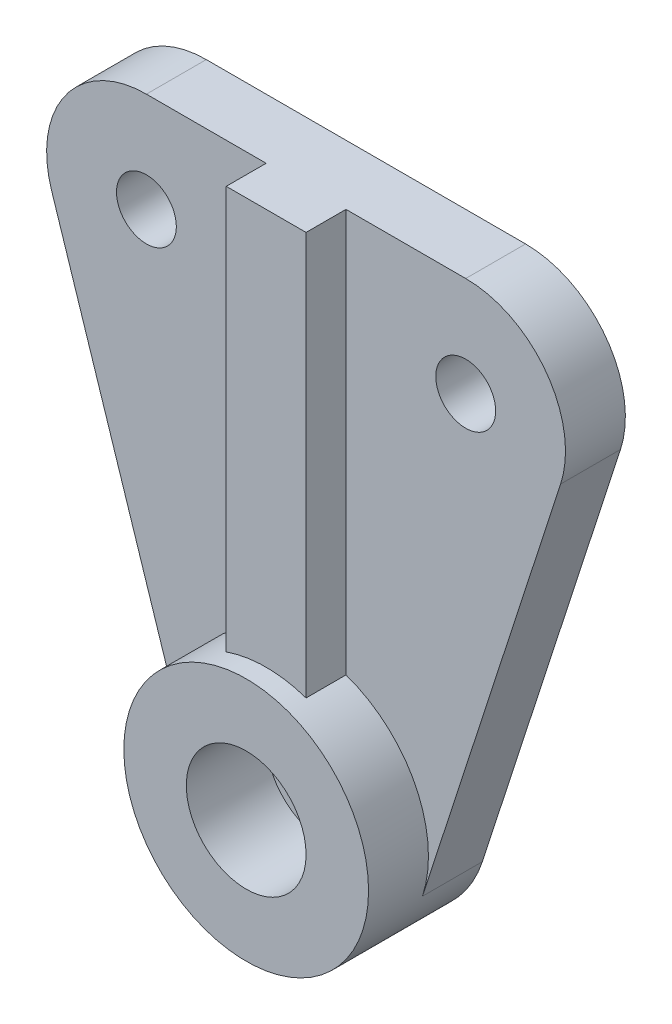
from build123d import *
from build123d.topology import SkipClean

# Parameters (mm, degrees)
SZKIC1_R                    = 2.75
SZKIC1_R_2                  = 1.5
DODANIE_WYCI_GNI_CIE1_DEPTH = 3
SZKIC2_R                    = 6.131623165
SZKIC2_R_2                  = 2.75
DODANIE_WYCI_GNI_CIE2_DEPTH = 3
SZKIC3_R                    = 3
SZKIC3_R_2                  = 1.6
DODANIE_WYCI_GNI_CIE3_DEPTH = 2
SZKIC4_W                    = 4
SZKIC4_H                    = 20.653159846
DODANIE_WYCI_GNI_CIE4_DEPTH = 2
SZKIC6_R                    = 3
WYTNIJ_WYCI_GNI_CIE1_DEPTH  = 4


with BuildPart() as part:
    # Szkic1 → Dodanie-wyciągnięcie1 (new body)
    with BuildSketch(Plane.XY):
        with BuildLine():
            Line((-8, 26), (8, 26))
            ThreePointArc((8, 26), (12.044264582, 23.940055101), (12.756144284, 19.457569598))
            Line((12.756144284, 19.457569598), (5.832576894, -1.891520397))
            ThreePointArc((5.832576894, -1.891520397), (0, -6.131623165), (-5.832576894, -1.891520397))
            Line((-5.832576894, -1.891520397), (-12.756144284, 19.457569598))
            ThreePointArc((-12.756144284, 19.457569598), (-12.044264582, 23.940055101), (-8, 26))
        make_face()
        Circle(SZKIC1_R, mode=Mode.SUBTRACT)
        with Locations((8, 21)):
            Circle(SZKIC1_R_2, mode=Mode.SUBTRACT)
        with Locations((-8, 21)):
            Circle(SZKIC1_R_2, mode=Mode.SUBTRACT)
    extrude(amount=DODANIE_WYCI_GNI_CIE1_DEPTH)

    # Szkic2 → Dodanie-wyciągnięcie2 (add)
    with BuildSketch(Plane.XY.offset(3)):
        with Locations(Location((0, 0, 0), (0, 0, 197.968018337))):
            Circle(SZKIC2_R)
        Circle(SZKIC2_R_2, mode=Mode.SUBTRACT)
    extrude(amount=DODANIE_WYCI_GNI_CIE2_DEPTH)

    # Szkic3 → Dodanie-wyciągnięcie3 (add)
    with BuildSketch(Plane(origin=(0, 0, 0), x_dir=(-1, 0, 0), z_dir=(0, 0, -1))):
        Circle(SZKIC3_R)
        Circle(SZKIC3_R_2, mode=Mode.SUBTRACT)
    extrude(amount=-DODANIE_WYCI_GNI_CIE3_DEPTH)

    # Szkic4 → Dodanie-wyciągnięcie4 (add)
    with BuildSketch(Plane.XY.offset(3)):
        with Locations((0, 15.673420077)):
            Rectangle(SZKIC4_W, SZKIC4_H)
    extrude(amount=DODANIE_WYCI_GNI_CIE4_DEPTH)

    # Szkic6 → Wytnij-wyciągnięcie1 (cut)
    with SkipClean():  # the faces are left unmerged after this step: merging them gives an invalid solid
        with BuildSketch(Plane.XY.offset(6)):
            Circle(SZKIC6_R)
        extrude(amount=-WYTNIJ_WYCI_GNI_CIE1_DEPTH, mode=Mode.SUBTRACT)


solid = part.part
